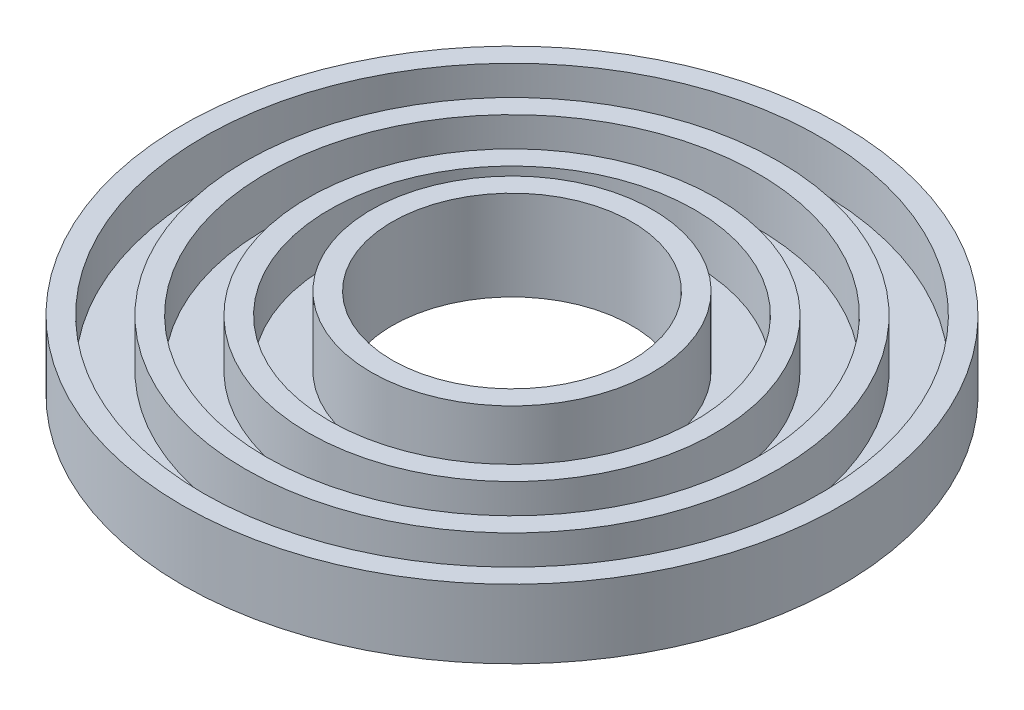
from build123d import *

# Parameters (mm, degrees)
CROQUIS1_R     = 11
CROQUIS1_R_2   = 4
EXTRUIR1_DEPTH = 0.7
CROQUIS2_R     = 11
CROQUIS2_R_2   = 10.3
CROQUIS2_R_3   = 8.9
CROQUIS2_R_4   = 8.2
CROQUIS2_R_5   = 6.8
CROQUIS2_R_6   = 6.1
CROQUIS2_R_7   = 4.7
CROQUIS2_R_8   = 4
EXTRUIR2_DEPTH = 1.6
CROQUIS3_R     = 4.7
CROQUIS3_R_2   = 4
EXTRUIR3_DEPTH = 0.7


with BuildPart() as part:
    # Croquis1 → Extruir1 (new body)
    with BuildSketch(Plane(origin=(0, 0, 0), x_dir=(1, 0, 0), z_dir=(0, 1, 0))):
        with Locations(Location((0, 0, 0), (0, 0, 270))):
            Circle(CROQUIS1_R)
        with Locations(Location((0, 0, 0), (0, 0, 270))):
            Circle(CROQUIS1_R_2, mode=Mode.SUBTRACT)
    extrude(amount=EXTRUIR1_DEPTH)

    # Croquis2 → Extruir2 (add)
    # profile 1 of 4: a face of its own
    with BuildSketch(Plane(origin=(0, 0.7, 0), x_dir=(1, 0, 0), z_dir=(0, 1, 0))):
        with Locations(Location((0, 0, 0), (0, 0, 270))):
            Circle(CROQUIS2_R)
        with Locations(Location((0, 0, 0), (0, 0, 270))):
            Circle(CROQUIS2_R_2, mode=Mode.SUBTRACT)
    # profile 2 of 4: a face of its own
    with BuildSketch(Plane(origin=(0, 0.7, 0), x_dir=(1, 0, 0), z_dir=(0, 1, 0))):
        with Locations(Location((0, 0, 0), (0, 0, 270))):
            Circle(CROQUIS2_R_3)
        with Locations(Location((0, 0, 0), (0, 0, 270))):
            Circle(CROQUIS2_R_4, mode=Mode.SUBTRACT)
    # profile 3 of 4: a face of its own
    with BuildSketch(Plane(origin=(0, 0.7, 0), x_dir=(1, 0, 0), z_dir=(0, 1, 0))):
        with Locations(Location((0, 0, 0), (0, 0, 270))):
            Circle(CROQUIS2_R_5)
        with Locations(Location((0, 0, 0), (0, 0, 270))):
            Circle(CROQUIS2_R_6, mode=Mode.SUBTRACT)
    # profile 4 of 4: a face of its own
    with BuildSketch(Plane(origin=(0, 0.7, 0), x_dir=(1, 0, 0), z_dir=(0, 1, 0))):
        with Locations(Location((0, 0, 0), (0, 0, 270))):
            Circle(CROQUIS2_R_7)
        with Locations(Location((0, 0, 0), (0, 0, 270))):
            Circle(CROQUIS2_R_8, mode=Mode.SUBTRACT)
    extrude(amount=EXTRUIR2_DEPTH)

    # Croquis3 → Extruir3 (add)
    with BuildSketch(Plane(origin=(0, 2.3, 0), x_dir=(1, 0, 0), z_dir=(0, 1, 0))):
        with Locations(Location((0, 0, 0), (0, 0, 270))):
            Circle(CROQUIS3_R)
        with Locations(Location((0, 0, 0), (0, 0, 270))):
            Circle(CROQUIS3_R_2, mode=Mode.SUBTRACT)
    extrude(amount=EXTRUIR3_DEPTH)


solid = part.part
